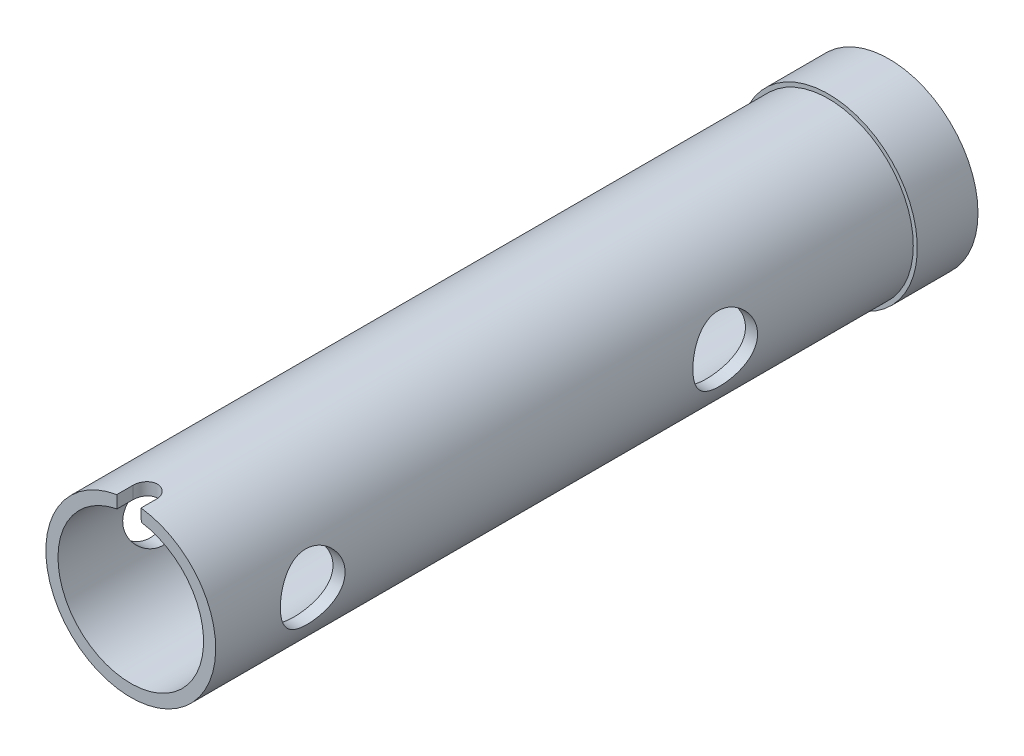
from build123d import *

# Parameters (mm, degrees)
SKETCH_1_R               = 11
SKETCH_1_R_2             = 9
EXTRUDE_1_DEPTH          = 7.5
SKETCH_3_R               = 10.5
SKETCH_3_R_2             = 9
EXTRUDE_2_DEPTH          = 86.25
CUT_EXTRUDE_1_DEPTH      = 86.25
CUT_EXTRUDE_1_DEPTH_BACK = 86.25
SKETCH_4_R               = 4
CUT_EXTRUDE_2_DEPTH      = 35.25


with BuildPart() as part:
    # 草图1 → 凸台-拉伸1 (new body)
    with BuildSketch(Plane.XY):
        with Locations(Location((-4.935418671, -158.561383044, 0), (0, 0, 180))):
            Circle(SKETCH_1_R)
        with Locations(Location((-4.935418671, -158.561383044, 0), (0, 0, 180))):
            Circle(SKETCH_1_R_2, mode=Mode.SUBTRACT)
    extrude(amount=EXTRUDE_1_DEPTH)

    # 草图3 → 凸台-拉伸2 (add)
    with BuildSketch(Plane.XY.offset(7.5)):
        with Locations(Location((-4.935418671, -158.561383044, 0), (0, 0, 180))):
            Circle(SKETCH_3_R)
        with Locations((-4.935418671, -158.561383044)):
            Circle(SKETCH_3_R_2, mode=Mode.SUBTRACT)
    extrude(amount=EXTRUDE_2_DEPTH)

    # 草图4 → 切除-拉伸1 (cut, two sides: drawn at the far end of the back side and taken through both)
    with BuildSketch(Plane(origin=(-8.503036589, -0.191549015, 0), x_dir=(0, 0, -1), z_dir=(0.9997463607277357, 0.022521416732707692, -5.695444116327053e-14)).offset(-CUT_EXTRUDE_1_DEPTH_BACK)):
        with Locations(Location((-81.75, -158.41001303, 0), (0, 0, 270))):
            Circle(SKETCH_4_R)
        with Locations(Location((-30.75, -158.41001303, 0), (0, 0, 270))):
            Circle(SKETCH_4_R)
    extrude(amount=CUT_EXTRUDE_1_DEPTH + CUT_EXTRUDE_1_DEPTH_BACK, mode=Mode.SUBTRACT)

    # 草图5 → 切除-拉伸2 (cut)
    with BuildSketch(Plane(origin=(3.567617918, -158.369834029, 0), x_dir=(0.9997463607277357, 0.022521416732707685, 0), z_dir=(-0.022521416732707685, 0.9997463607277357, 0))):
        with BuildLine():
            Line((-10.00519384, -93.75), (-10.00519384, -91.75))
            ThreePointArc((-10.00519384, -91.75), (-8.50519384, -90.25), (-7.00519384, -91.75))
            Line((-7.00519384, -91.75), (-7.00519384, -93.75))
            ThreePointArc((-7.00519384, -93.75), (-8.50519384, -95.25), (-10.00519384, -93.75))
        make_face()
    extrude(amount=CUT_EXTRUDE_2_DEPTH, mode=Mode.SUBTRACT)


solid = part.part
